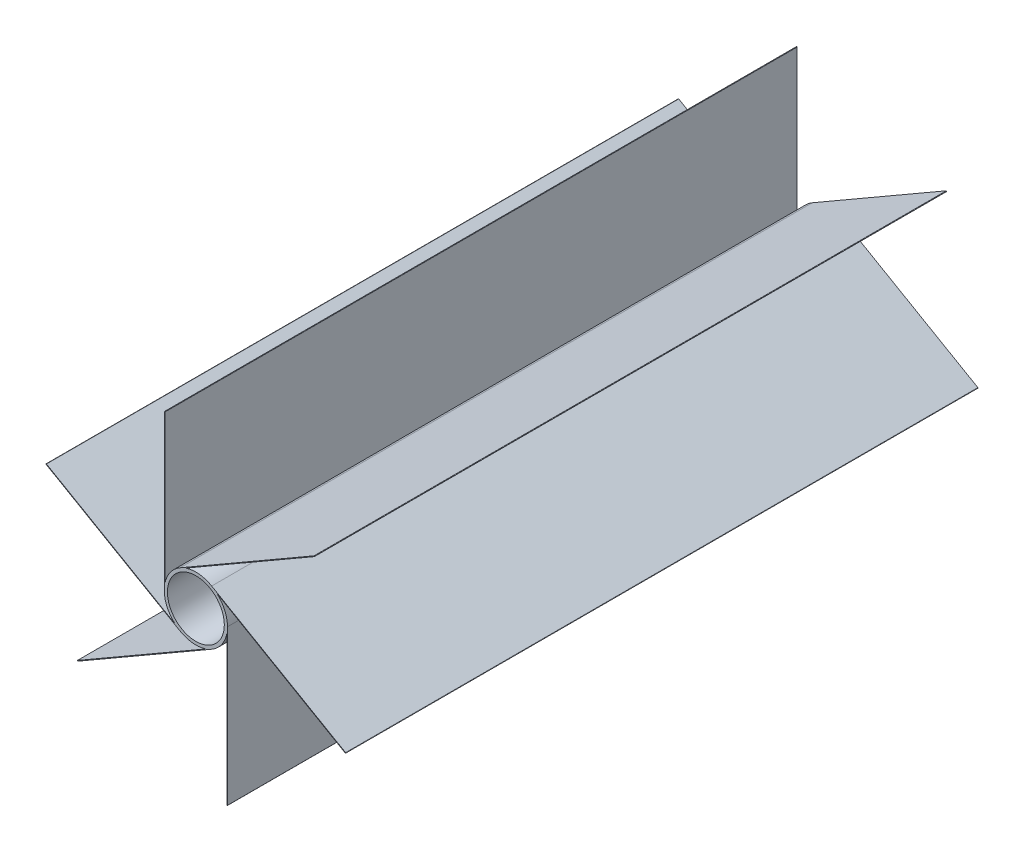
from build123d import *

# Parameters (mm, degrees)
SKETCH2_R           = 45
BOSS_EXTRUDE1_DEPTH = 1000
SKETCH3_R           = 12.5
BOSS_EXTRUDE2_DEPTH = 27
SKETCH4_R           = 10
BOSS_EXTRUDE3_DEPTH = 48
SKETCH12_R          = 45
BOSS_EXTRUDE4_DEPTH = 10


with BuildPart() as part:
    # Sketch2 → Boss-Extrude1 (new body)
    with BuildSketch(Plane.XY):
        with BuildLine():
            Line((-50, 0), (-50, 244.540385213))
            ThreePointArc((-50, 244.540385213), (-49.5, 245.040385213), (-49, 244.540385213))
            Line((-49, 244.540385213), (-49, 9.949874371))
            ThreePointArc((-49, 9.949874371), (-40.584219849, 29.204812947), (-25, 43.301270189))
            Line((-25, 43.301270189), (186.778185845, 165.571462796))
            ThreePointArc((186.778185845, 165.571462796), (187.461198547, 165.388450094), (187.278185845, 164.705437392))
            Line((187.278185845, 164.705437392), (-15.88315603, 47.410181971))
            ThreePointArc((-15.88315603, 47.410181971), (5, 49.749371855), (25, 43.301270189))
            Line((25, 43.301270189), (236.778185845, -78.968922417))
            ThreePointArc((236.778185845, -78.968922417), (236.961198547, -79.651935119), (236.278185845, -79.834947821))
            Line((236.278185845, -79.834947821), (33.11684397, 37.4603076))
            ThreePointArc((33.11684397, 37.4603076), (45.584219849, 20.544558909), (50, 0))
            Line((50, 0), (50, -244.540385213))
            ThreePointArc((50, -244.540385213), (49.5, -245.040385213), (49, -244.540385213))
            Line((49, -244.540385213), (49, -9.949874371))
            ThreePointArc((49, -9.949874371), (40.584219849, -29.204812947), (25, -43.301270189))
            Line((25, -43.301270189), (-186.778185845, -165.571462796))
            ThreePointArc((-186.778185845, -165.571462796), (-187.461198547, -165.388450094), (-187.278185845, -164.705437392))
            Line((-187.278185845, -164.705437392), (15.88315603, -47.410181971))
            ThreePointArc((15.88315603, -47.410181971), (-5, -49.749371855), (-25, -43.301270189))
            Line((-25, -43.301270189), (-236.778185845, 78.968922417))
            ThreePointArc((-236.778185845, 78.968922417), (-236.961198547, 79.651935119), (-236.278185845, 79.834947821))
            Line((-236.278185845, 79.834947821), (-33.11684397, -37.4603076))
            ThreePointArc((-33.11684397, -37.4603076), (-45.584219849, -20.544558909), (-50, 0))
        make_face()
        Circle(SKETCH2_R, mode=Mode.SUBTRACT)
    extrude(amount=BOSS_EXTRUDE1_DEPTH)


with BuildPart() as body_2:
    # Sketch3 → Boss-Extrude2 (new body)
    with BuildSketch(Plane(origin=(0, 0, 0), x_dir=(-1, 0, 0), z_dir=(0, 0, -1))):
        Circle(SKETCH3_R)
    extrude(amount=BOSS_EXTRUDE2_DEPTH)

    # Sketch12 → Boss-Extrude4 (add)
    with BuildSketch(Plane(origin=(0, 0, 0), x_dir=(-1, 0, 0), z_dir=(0, 0, -1))):
        Circle(SKETCH12_R)
    extrude(amount=-BOSS_EXTRUDE4_DEPTH)


with BuildPart() as body_3:
    # Sketch4 → Boss-Extrude3 (new body)
    with BuildSketch(Plane(origin=(0, 0, -27), x_dir=(-1, 0, 0), z_dir=(0, 0, -1))):
        Circle(SKETCH4_R)
    extrude(amount=BOSS_EXTRUDE3_DEPTH)


solid = Compound([part.part, body_2.part, body_3.part])
